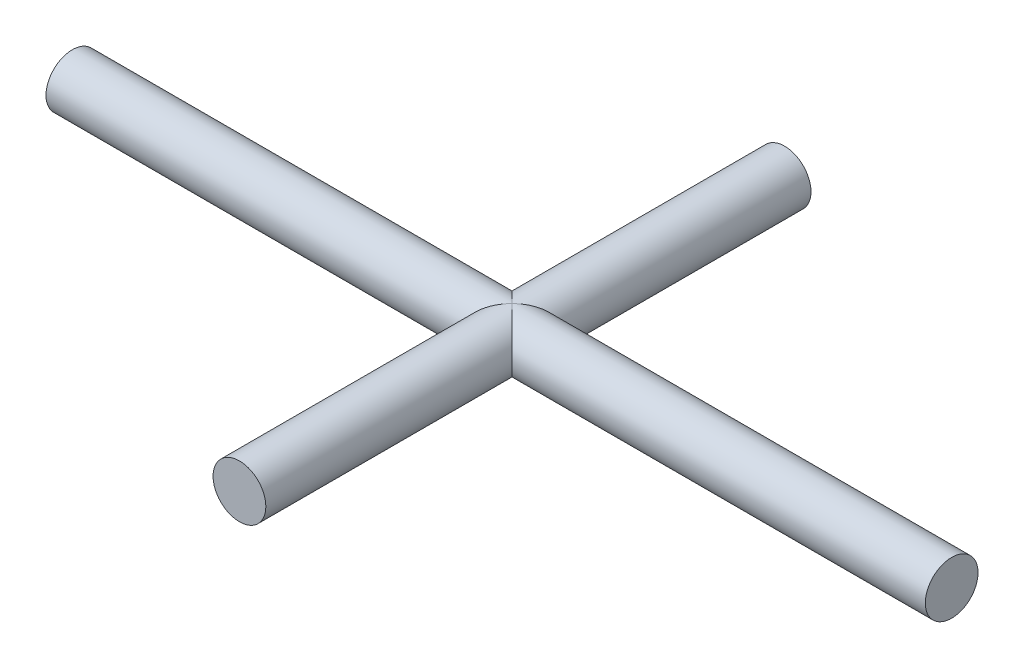
from build123d import *

# Parameters (mm, degrees)
SKETCH_1_W = 100
SKETCH_1_H = 3
SKETCH_2_W = 62
SKETCH_2_H = 3


with BuildPart() as part:
    # 草图1 → 旋转1 (revolve)
    with BuildSketch(Plane.XY, mode=Mode.PRIVATE) as revolve_1_sk:
        with Locations((0, 1.5)):
            Rectangle(SKETCH_1_W, SKETCH_1_H)
    revolve(revolve_1_sk.sketch.rotate(Axis((-50, 0, 0), (1, 0, 0)), 90), axis=Axis((-50, 0, 0), (1, 0, 0)))

    # 草图2 → 旋转3 (revolve)
    with BuildSketch(Plane(origin=(0, 0, 0), x_dir=(0, 0, -1), z_dir=(1, 0, 0)), mode=Mode.PRIVATE) as revolve_3_sk:
        with Locations((0, 1.5)):
            Rectangle(SKETCH_2_W, SKETCH_2_H)
    revolve(revolve_3_sk.sketch.rotate(Axis((0, 0, 31), (0, 0, -1)), 90), axis=Axis((0, 0, 31), (0, 0, -1)))


solid = part.part
